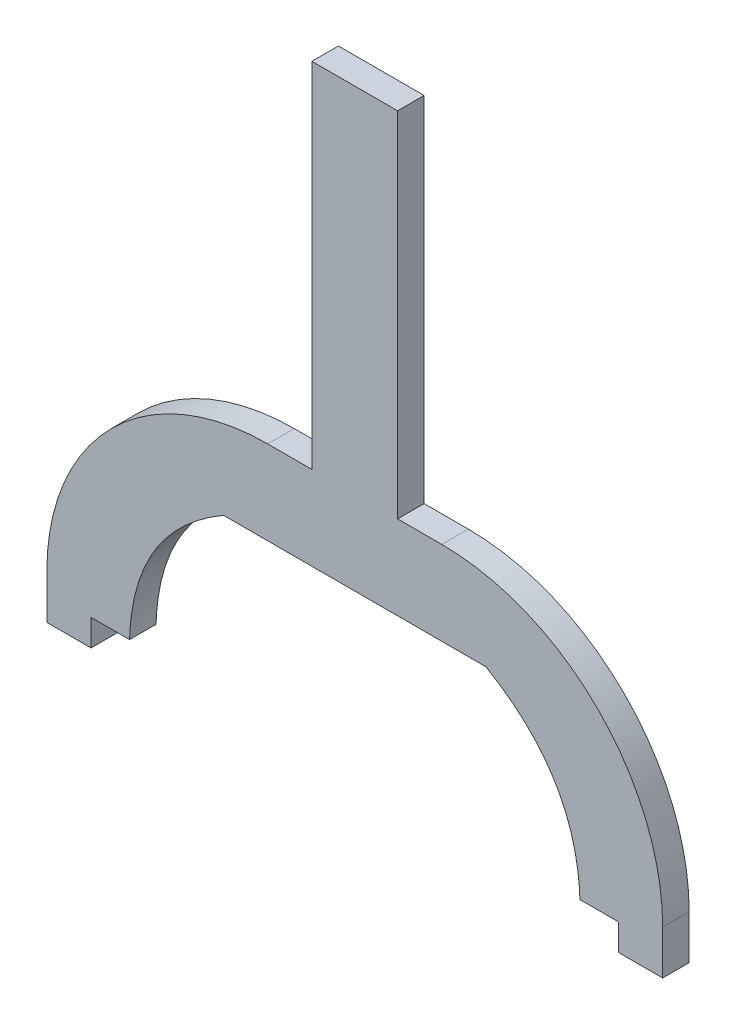
from build123d import *

# Parameters (mm, degrees)
BOSS_EXTRUDE1_DEPTH = 7.62
FILLET1_R           = 63.5
CUT_EXTRUDE1_DEPTH  = 155.990666284


with BuildPart() as part:
    # Sketch2 → Boss-Extrude1 (new body)
    with BuildSketch(Plane.XY):
        Polygon((12.315773934, -50.8), (88.515773934, -50.8), (88.515773934, -127), (75.815773934, -127), (75.815773934, -119.38), (37.715773934, -119.38), (37.715773934, -74.93), (-37.715773934, -74.93), (-37.715773934, -119.38), (-75.815773934, -119.38), (-75.815773934, -127), (-88.515773934, -127), (-88.515773934, -50.8), (-12.315773934, -50.8), (-12.315773934, 50.8), (12.315773934, 50.8), align=None)
    extrude(amount=BOSS_EXTRUDE1_DEPTH)

    # Fillet1
    fillet1_edges = [part.edges().sort_by_distance(p)[0] for p in [
        (88.515773934, -50.8, 3.81),
        (-88.515773934, -50.8, 3.81),
    ]]
    fillet(fillet1_edges, radius=FILLET1_R)

    # Sketch3 → Cut-Extrude1 (cut, through all)
    with BuildSketch(Plane.XY.offset(7.62)):
        with BuildLine():
            Line((-37.715773934, -74.93), (-37.715773934, -119.38))
            Line((-37.715773934, -119.38), (-64.735615427, -119.38))
            add(Edge.make_bspline(
                [(-64.735615427, -119.38), (-63.844183293, -90.073264765), (-37.715773934, -74.93)],
                knots=[0, 0, 0, 1, 1, 1], degree=2))
        make_face()
    cut_extrude1 = extrude(amount=-CUT_EXTRUDE1_DEPTH, mode=Mode.SUBTRACT)

    # Mirror1: Cut-Extrude1 across plane
    add(cut_extrude1.mirror(Plane.ZY), mode=Mode.SUBTRACT)


solid = part.part
